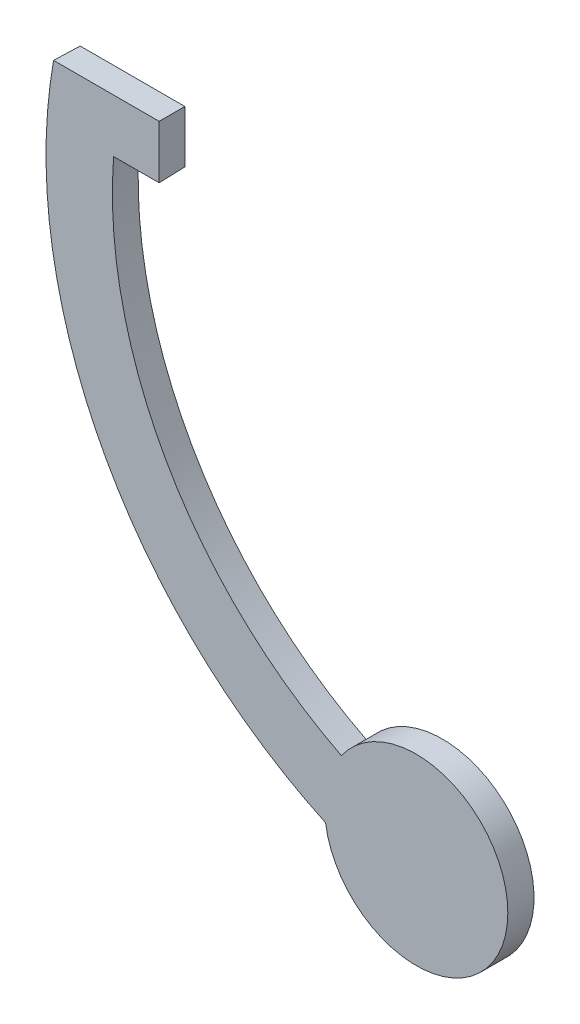
from build123d import *

# Parameters (mm, degrees)
BOSS_EXTRU_2_DEPTH = 2
BOSS_EXTRU_8_DEPTH = 2
BOSS_EXTRU_8_DRAFT = 1


with BuildPart() as part:
    # Esquisse1 → Boss.-Extru.2 (new body)
    with BuildSketch(Plane.XY):
        with BuildLine():
            ThreePointArc((6.427291801, -2.77307052), (5.965216185, -3.662812562), (5.380773926, -4.477418002))
            ThreePointArc((5.380773926, -4.477418002), (-5.965216185, 3.662812562), (6.427291801, -2.77307052))
        make_face()
    extrude(amount=BOSS_EXTRU_2_DEPTH)


with BuildPart() as boss_extru_8_tool:
    # Esquisse7 → Boss.-Extru.8 (with draft: the straight prism first)
    with BuildSketch(Plane(origin=(0, 0, 0), x_dir=(-1, 0, 0), z_dir=(0, 0, -1))):
        with BuildLine():
            Line((27.675381467, 39.011893522), (19.675381467, 39.011893522))
            Line((19.675381467, 39.011893522), (19.675381467, 35.011893522))
            Line((19.675381467, 35.011893522), (23.151678354, 35.011893522))
            ThreePointArc((23.151678354, 35.011893522), (19.150512425, 16.86781666), (5.736262752, 4.011893522))
            ThreePointArc((5.736262752, 4.011893522), (6.806086868, 1.636209506), (6.933004295, -0.966152912))
            ThreePointArc((6.933004295, -0.966152912), (24.093742024, 15.500152171), (27.675381467, 39.011893522))
        make_face()
    extrude(amount=-BOSS_EXTRU_8_DEPTH)
    # Boss.-Extru.8: the draft: its side faces are tilted about the plane it starts from
    boss_extru_8_sides = [boss_extru_8_tool.faces().sort_by_distance(p)[0] for p in [
        (-24.093742024, 15.500152171, 1),
        (-23.675381467, 39.011893522, 1),
        (-19.675381467, 37.011893522, 1),
        (-21.413529911, 35.011893522, 1),
        (-19.150512425, 16.86781666, 1),
        (-6.806086868, 1.636209506, 1),
    ]]
    draft(boss_extru_8_sides, Plane(origin=(0, 0, 0), x_dir=(-1, 0, 0), z_dir=(0, 0, -1)), BOSS_EXTRU_8_DRAFT)


with BuildPart() as part_1:
    add(part.part)

    # Boss.-Extru.8: add boss_extru_8_tool
    add(boss_extru_8_tool.part)


solid = part_1.part
